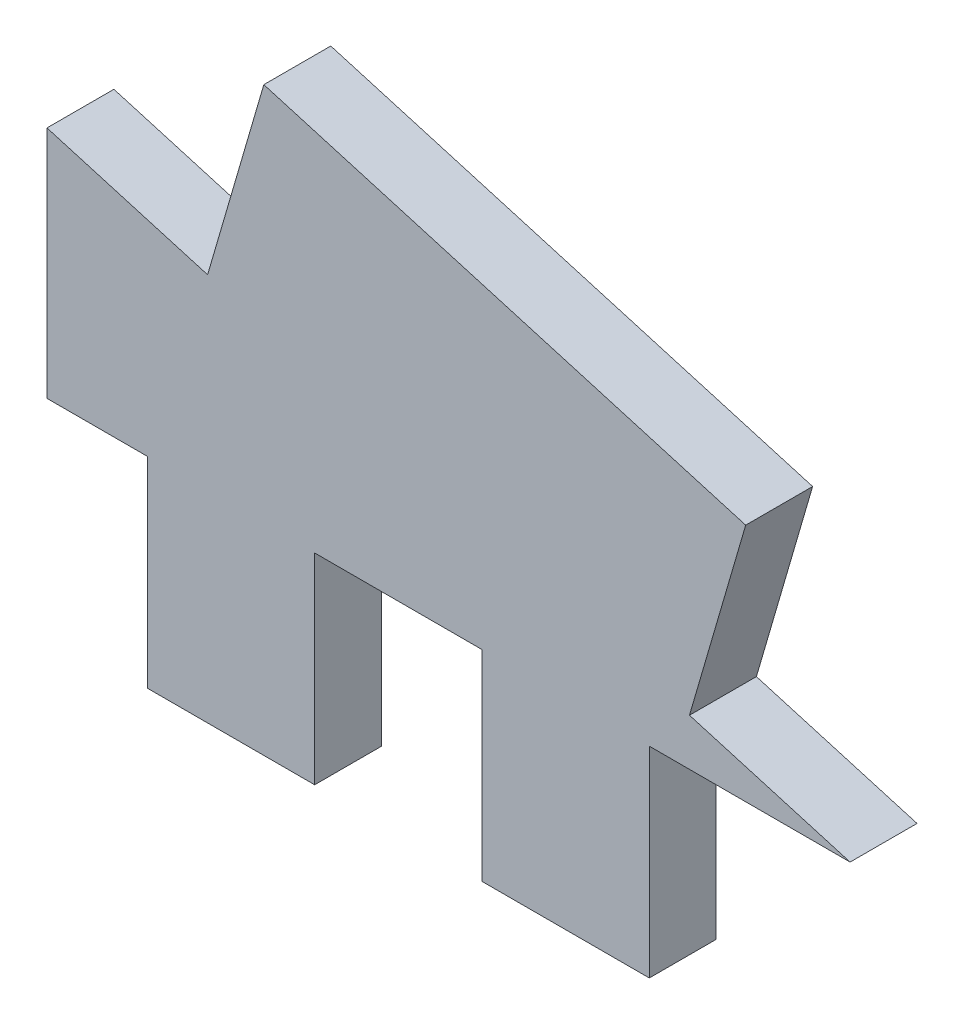
from build123d import *

# Parameters (mm, degrees)
Y_KSEKLIK_EKSTR_ZYON2_DEPTH = 2


with BuildPart() as part:
    # Çizim2 → Yükseklik-Ekstrüzyon2 (new body)
    with BuildSketch(Plane.XY):
        Polygon((0, 7), (0, 0), (3, 0), (3, -6), (8, -6), (8, 0), (13, 0), (13, -6), (18, -6), (18, 0), (24, 0), (19.2, 1.4), (20.88, 7.16), (6.48, 11.36), (4.8, 5.6), align=None)
    extrude(amount=Y_KSEKLIK_EKSTR_ZYON2_DEPTH)


solid = part.part
